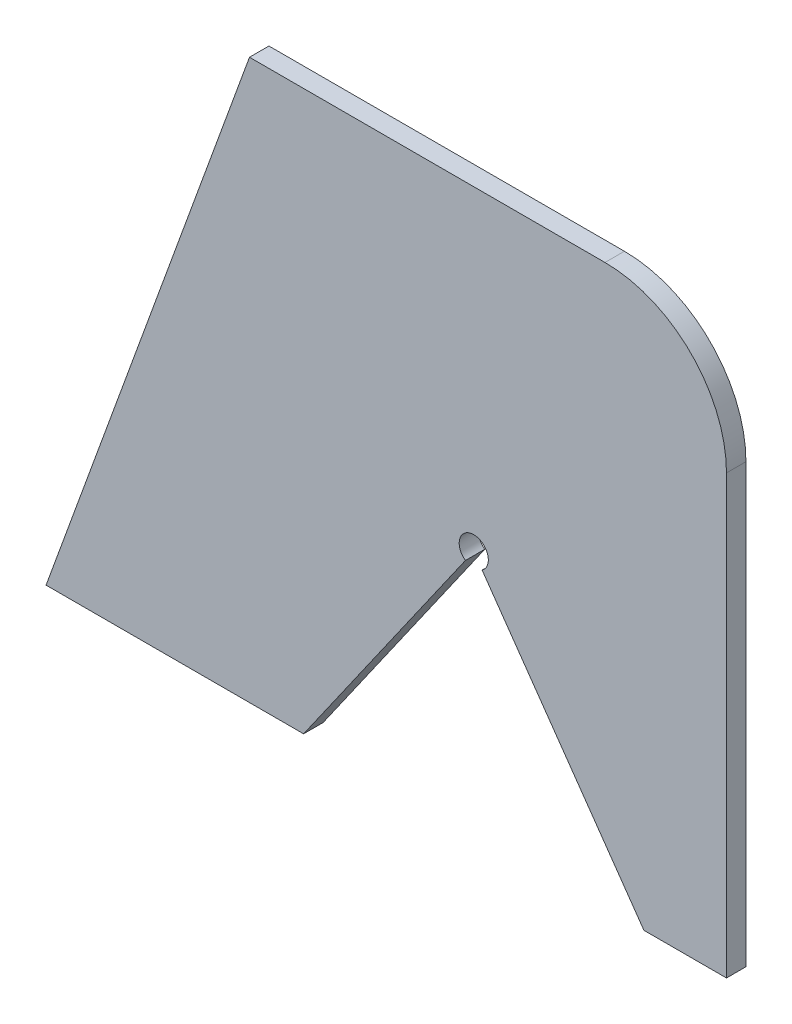
from build123d import *

# Parameters (mm, degrees)
AUFSATZ_LINEAR_AUSTRAGEN1_DEPTH = 4


with BuildPart() as part:
    # Skizze1 → Aufsatz-Linear austragen1 (new body)
    with BuildSketch(Plane.XY):
        with BuildLine():
            Line((0, 0), (52.98962309, 0))
            Line((52.98962309, 0), (86.279270691, 47.542543867))
            ThreePointArc((86.279270691, 47.542543867), (88, 53), (89.720729309, 47.542543867))
            Line((89.720729309, 47.542543867), (123.01037691, 0))
            Line((123.01037691, 0), (140, 0))
            Line((140, 0), (140, 90))
            ThreePointArc((140, 90), (132.67766953, 107.67766953), (115, 115))
            Line((115, 115), (41.856576941, 115))
            Line((41.856576941, 115), (0, 0))
        make_face()
    extrude(amount=AUFSATZ_LINEAR_AUSTRAGEN1_DEPTH)


solid = part.part
